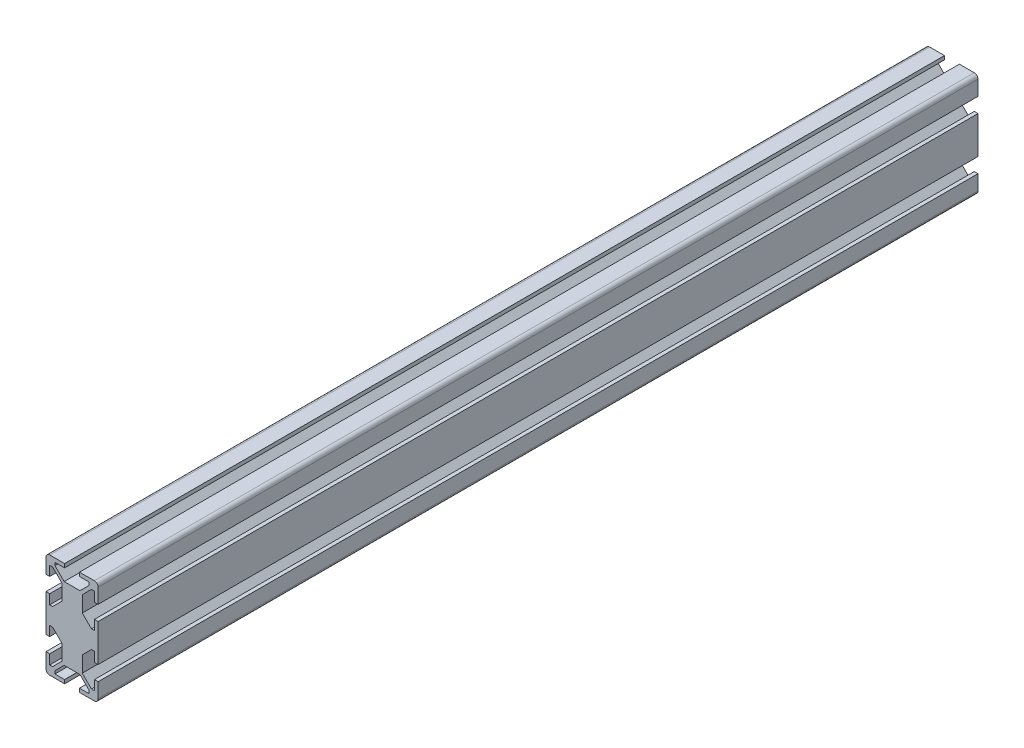
from build123d import *

# Parameters (mm, degrees)
EXTRUSION2_DEPTH           = 161.5
EXTRUSION2_DEPTH_BACK      = 161.5
SKETCH1_R                  = 3.25
F_4_7_4_7_DIAMETER_HOLE1_D = 4.75
BOSS_EXTRUDE1_DEPTH        = 150


with BuildPart() as part:
    # Sketch1 → Extrusion2 (new, two sides: drawn at the far end of the back side and taken through both)
    with BuildSketch(Plane.XY.offset(-EXTRUSION2_DEPTH_BACK)):
        with BuildLine():
            Line((-51.945456549, 19.536039976), (-51.945456549, -0.463960024))
            Line((-51.945456549, -0.463960024), (-49.945456549, -0.463960024))
            Line((-49.945456549, -0.463960024), (-49.945456549, 4.741263919))
            Line((-49.945456549, 4.741263919), (-48.386244669, 4.741263919))
            Line((-48.386244669, 4.741263919), (-43.445456549, -0.1995242))
            Line((-43.445456549, -0.1995242), (-43.445456549, -8.717947961))
            Line((-43.445456549, -8.717947961), (-48.386244669, -13.658736081))
            Line((-48.386244669, -13.658736081), (-49.945456549, -13.658736081))
            Line((-49.945456549, -13.658736081), (-49.945456549, -8.458736081))
            Line((-49.945456549, -8.458736081), (-51.945456549, -8.458736081))
            Line((-51.945456549, -8.458736081), (-51.945456549, -16.458736081))
            ThreePointArc((-51.945456549, -16.458736081), (-51.359670111, -17.872949643), (-49.945456549, -18.458736081))
            Line((-49.945456549, -18.458736081), (-41.945456549, -18.458736081))
            Line((-41.945456549, -18.458736081), (-41.945456549, -16.458736081))
            Line((-41.945456549, -16.458736081), (-47.145456549, -16.458736081))
            Line((-47.145456549, -16.458736081), (-47.145456549, -14.8995242))
            Line((-47.145456549, -14.8995242), (-42.204668429, -9.958736081))
            Line((-42.204668429, -9.958736081), (-33.686244669, -9.958736081))
            Line((-33.686244669, -9.958736081), (-28.745456549, -14.8995242))
            Line((-28.745456549, -14.8995242), (-28.745456549, -16.458736081))
            Line((-28.745456549, -16.458736081), (-33.945456549, -16.458736081))
            Line((-33.945456549, -16.458736081), (-33.945456549, -18.458736081))
            Line((-33.945456549, -18.458736081), (-25.945456549, -18.458736081))
            ThreePointArc((-25.945456549, -18.458736081), (-24.531242987, -17.872949643), (-23.945456549, -16.458736081))
            Line((-23.945456549, -16.458736081), (-23.945456549, -8.458736081))
            Line((-23.945456549, -8.458736081), (-25.945456549, -8.458736081))
            Line((-25.945456549, -8.458736081), (-25.945456549, -13.658736081))
            Line((-25.945456549, -13.658736081), (-27.504668429, -13.658736081))
            Line((-27.504668429, -13.658736081), (-32.445456549, -8.717947961))
            Line((-32.445456549, -8.717947961), (-32.445456549, -0.1995242))
            Line((-32.445456549, -0.1995242), (-27.504668429, 4.741263919))
            Line((-27.504668429, 4.741263919), (-25.945456549, 4.741263919))
            Line((-25.945456549, 4.741263919), (-25.945456549, -0.463960024))
            Line((-25.945456549, -0.463960024), (-23.945456549, -0.463960024))
            Line((-23.945456549, -0.463960024), (-23.945456549, 19.541263919))
            Line((-23.945456549, 19.541263919), (-25.945456549, 19.541263919))
            Line((-25.945456549, 19.541263919), (-25.945456549, 14.341263919))
            Line((-25.945456549, 14.341263919), (-27.504668429, 14.341263919))
            Line((-27.504668429, 14.341263919), (-32.445456549, 19.282052039))
            Line((-32.445456549, 19.282052039), (-32.445456549, 27.8004758))
            Line((-32.445456549, 27.8004758), (-27.504668429, 32.741263919))
            Line((-27.504668429, 32.741263919), (-25.945456549, 32.741263919))
            Line((-25.945456549, 32.741263919), (-25.945456549, 27.541263919))
            Line((-25.945456549, 27.541263919), (-23.945456549, 27.541263919))
            Line((-23.945456549, 27.541263919), (-23.945456549, 35.541263919))
            ThreePointArc((-23.945456549, 35.541263919), (-24.531242987, 36.955477482), (-25.945456549, 37.541263919))
            Line((-25.945456549, 37.541263919), (-33.945456549, 37.541263919))
            Line((-33.945456549, 37.541263919), (-33.945456549, 35.541263919))
            Line((-33.945456549, 35.541263919), (-28.745456549, 35.541263919))
            Line((-28.745456549, 35.541263919), (-28.745456549, 33.982052039))
            Line((-28.745456549, 33.982052039), (-33.686244669, 29.041263919))
            Line((-33.686244669, 29.041263919), (-42.204668429, 29.041263919))
            Line((-42.204668429, 29.041263919), (-47.145456549, 33.982052039))
            Line((-47.145456549, 33.982052039), (-47.145456549, 35.541263919))
            Line((-47.145456549, 35.541263919), (-41.945456549, 35.541263919))
            Line((-41.945456549, 35.541263919), (-41.945456549, 37.541263919))
            Line((-41.945456549, 37.541263919), (-49.945456549, 37.541263919))
            ThreePointArc((-49.945456549, 37.541263919), (-51.359670111, 36.955477482), (-51.945456549, 35.541263919))
            Line((-51.945456549, 35.541263919), (-51.945456549, 27.541263919))
            Line((-51.945456549, 27.541263919), (-49.945456549, 27.541263919))
            Line((-49.945456549, 27.541263919), (-49.945456549, 32.736039976))
            Line((-49.945456549, 32.736039976), (-48.372120999, 32.736039976))
            Line((-48.372120999, 32.736039976), (-43.43133288, 27.795251856))
            Line((-43.43133288, 27.795251856), (-43.43133288, 19.276828096))
            Line((-43.43133288, 19.276828096), (-48.372120999, 14.336039976))
            Line((-48.372120999, 14.336039976), (-49.93133288, 14.336039976))
            Line((-49.93133288, 14.336039976), (-49.93133288, 19.536039976))
            Line((-49.93133288, 19.536039976), (-51.945456549, 19.536039976))
        make_face()
        with Locations((-37.945456549, -4.458736081)):
            Circle(SKETCH1_R, mode=Mode.SUBTRACT)
        with Locations((-37.945456549, 23.541263919)):
            Circle(SKETCH1_R, mode=Mode.SUBTRACT)
        Polygon((-33.686244669, 18.041263919), (-42.204668429, 18.041263919), (-47.145456549, 13.1004758), (-47.145456549, 5.982052039), (-42.204668429, 1.041263919), (-33.686244669, 1.041263919), (-28.745456549, 5.982052039), (-28.745456549, 13.1004758), align=None, mode=Mode.SUBTRACT)
    extrude(amount=EXTRUSION2_DEPTH + EXTRUSION2_DEPTH_BACK)

    # Ø4.7 (4.7) Diameter Hole1 (through all)
    with Locations(Plane(origin=(-23.945456549, 0, 0), x_dir=(0, 0, -1), z_dir=(1, 0, 0))):
        with Locations((-140.5, 23.541263919), (140.5, 23.541263919)):
            Hole(F_4_7_4_7_DIAMETER_HOLE1_D / 2)

    # Sketch5 → Boss-Extrude1 (add)
    with BuildSketch(Plane.XY.offset(161.5)):
        with BuildLine():
            Line((-41.945456549, 37.541263919), (-49.945456549, 37.541263919))
            ThreePointArc((-49.945456549, 37.541263919), (-51.359670111, 36.955477482), (-51.945456549, 35.541263919))
            Line((-51.945456549, 35.541263919), (-51.945456549, 27.541263919))
            Line((-51.945456549, 27.541263919), (-49.945456549, 27.541263919))
            Line((-49.945456549, 27.541263919), (-49.945456549, 32.736039976))
            Line((-49.945456549, 32.736039976), (-48.372120999, 32.736039976))
            Line((-48.372120999, 32.736039976), (-43.43133288, 27.795251856))
            Line((-43.43133288, 27.795251856), (-43.43133288, 19.276828096))
            Line((-43.43133288, 19.276828096), (-48.372120999, 14.336039976))
            Line((-48.372120999, 14.336039976), (-49.93133288, 14.336039976))
            Line((-49.93133288, 14.336039976), (-49.93133288, 19.536039976))
            Line((-49.93133288, 19.536039976), (-51.945456549, 19.536039976))
            Line((-51.945456549, 19.536039976), (-51.945456549, -0.463960024))
            Line((-51.945456549, -0.463960024), (-49.945456549, -0.463960024))
            Line((-49.945456549, -0.463960024), (-49.945456549, 4.741263919))
            Line((-49.945456549, 4.741263919), (-48.386244669, 4.741263919))
            Line((-48.386244669, 4.741263919), (-43.445456549, -0.1995242))
            Line((-43.445456549, -0.1995242), (-43.445456549, -8.717947961))
            Line((-43.445456549, -8.717947961), (-48.386244669, -13.658736081))
            Line((-48.386244669, -13.658736081), (-49.945456549, -13.658736081))
            Line((-49.945456549, -13.658736081), (-49.945456549, -8.458736081))
            Line((-49.945456549, -8.458736081), (-51.945456549, -8.458736081))
            Line((-51.945456549, -8.458736081), (-51.945456549, -16.458736081))
            ThreePointArc((-51.945456549, -16.458736081), (-51.359670111, -17.872949643), (-49.945456549, -18.458736081))
            Line((-49.945456549, -18.458736081), (-41.945456549, -18.458736081))
            Line((-41.945456549, -18.458736081), (-41.945456549, -16.458736081))
            Line((-41.945456549, -16.458736081), (-47.145456549, -16.458736081))
            Line((-47.145456549, -16.458736081), (-47.145456549, -14.8995242))
            Line((-47.145456549, -14.8995242), (-42.204668429, -9.958736081))
            Line((-42.204668429, -9.958736081), (-33.686244669, -9.958736081))
            Line((-33.686244669, -9.958736081), (-28.745456549, -14.8995242))
            Line((-28.745456549, -14.8995242), (-28.745456549, -16.458736081))
            Line((-28.745456549, -16.458736081), (-33.945456549, -16.458736081))
            Line((-33.945456549, -16.458736081), (-33.945456549, -18.458736081))
            Line((-33.945456549, -18.458736081), (-25.945456549, -18.458736081))
            ThreePointArc((-25.945456549, -18.458736081), (-24.531242987, -17.872949643), (-23.945456549, -16.458736081))
            Line((-23.945456549, -16.458736081), (-23.945456549, -8.458736081))
            Line((-23.945456549, -8.458736081), (-25.945456549, -8.458736081))
            Line((-25.945456549, -8.458736081), (-25.945456549, -13.658736081))
            Line((-25.945456549, -13.658736081), (-27.504668429, -13.658736081))
            Line((-27.504668429, -13.658736081), (-32.445456549, -8.717947961))
            Line((-32.445456549, -8.717947961), (-32.445456549, -0.1995242))
            Line((-32.445456549, -0.1995242), (-27.504668429, 4.741263919))
            Line((-27.504668429, 4.741263919), (-25.945456549, 4.741263919))
            Line((-25.945456549, 4.741263919), (-25.945456549, -0.463960024))
            Line((-25.945456549, -0.463960024), (-23.945456549, -0.463960024))
            Line((-23.945456549, -0.463960024), (-23.945456549, 19.541263919))
            Line((-23.945456549, 19.541263919), (-25.945456549, 19.541263919))
            Line((-25.945456549, 19.541263919), (-25.945456549, 14.341263919))
            Line((-25.945456549, 14.341263919), (-27.504668429, 14.341263919))
            Line((-27.504668429, 14.341263919), (-32.445456549, 19.282052039))
            Line((-32.445456549, 19.282052039), (-32.445456549, 27.8004758))
            Line((-32.445456549, 27.8004758), (-27.504668429, 32.741263919))
            Line((-27.504668429, 32.741263919), (-25.945456549, 32.741263919))
            Line((-25.945456549, 32.741263919), (-25.945456549, 27.541263919))
            Line((-25.945456549, 27.541263919), (-23.945456549, 27.541263919))
            Line((-23.945456549, 27.541263919), (-23.945456549, 35.541263919))
            ThreePointArc((-23.945456549, 35.541263919), (-24.531242987, 36.955477482), (-25.945456549, 37.541263919))
            Line((-25.945456549, 37.541263919), (-33.945456549, 37.541263919))
            Line((-33.945456549, 37.541263919), (-33.945456549, 35.541263919))
            Line((-33.945456549, 35.541263919), (-28.745456549, 35.541263919))
            Line((-28.745456549, 35.541263919), (-28.745456549, 33.982052039))
            Line((-28.745456549, 33.982052039), (-33.686244669, 29.041263919))
            Line((-33.686244669, 29.041263919), (-42.204668429, 29.041263919))
            Line((-42.204668429, 29.041263919), (-47.145456549, 33.982052039))
            Line((-47.145456549, 33.982052039), (-47.145456549, 35.541263919))
            Line((-47.145456549, 35.541263919), (-41.945456549, 35.541263919))
            Line((-41.945456549, 35.541263919), (-41.945456549, 37.541263919))
        make_face()
    extrude(amount=BOSS_EXTRUDE1_DEPTH)


solid = part.part
